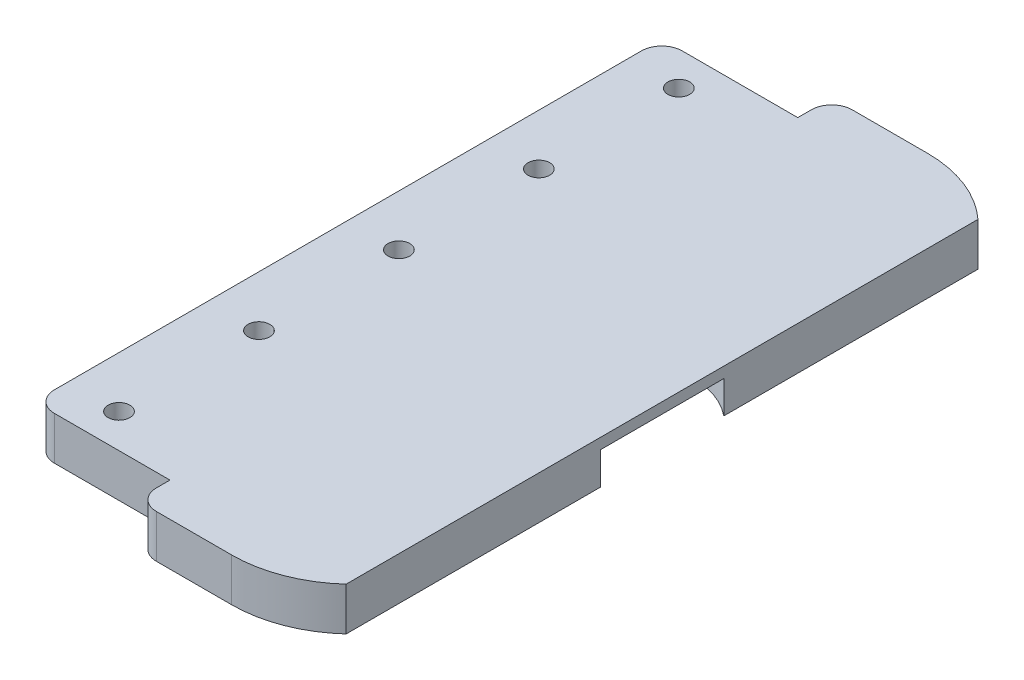
from build123d import *

# Parameters (mm, degrees)
SKETCH1_W           = 52.084
SKETCH1_H           = 102.362
BOSS_EXTRUDE1_DEPTH = 6.35
SKETCH1_4_R         = 1.6
CUT_EXTRUDE2_DEPTH  = 116.026277867
SKETCH1_5_R         = 3.45
CUT_EXTRUDE3_DEPTH  = 4.7625
FILLET1_R           = 18
SKETCH1_7_W         = 20
SKETCH1_7_H         = 5
CUT_EXTRUDE4_DEPTH  = 116.026277867
FILLET4_R           = 3
SKETCH3_W           = 22.451753575
SKETCH3_H           = 92.950303638
CUT_EXTRUDE6_DEPTH  = 6.35


with BuildPart() as part:
    # Sketch1 → Boss-Extrude1 (new body)
    with BuildSketch(Plane(origin=(0, 0, 0), x_dir=(1, 0, 0), z_dir=(0, 1, 0))):
        with Locations((26.042, 51.181)):
            Rectangle(SKETCH1_W, SKETCH1_H)
    extrude(amount=BOSS_EXTRUDE1_DEPTH)

    # Sketch1<4> → Cut-Extrude2 (cut, through all)
    with BuildSketch(Plane(origin=(0, 0, 0), x_dir=(1, 0, 0), z_dir=(0, 1, 0))):
        with BuildLine():
            ThreePointArc((9.1, 71.772), (8.63137085, 72.90337085), (7.5, 73.372))
            Line((7.5, 73.372), (7.5, 70.172))
            ThreePointArc((7.5, 70.172), (8.63137085, 70.64062915), (9.1, 71.772))
        make_face()
        with BuildLine():
            Line((7.5, 70.172), (7.5, 73.372))
            ThreePointArc((7.5, 73.372), (5.9, 71.772), (7.5, 70.172))
        make_face()
        with Locations(Location((7.5, 92.362, 0), (0, 0, 270))):
            Circle(SKETCH1_4_R)
        with Locations(Location((7.5, 51.182, 0), (0, 0, 270))):
            Circle(SKETCH1_4_R)
        with Locations(Location((7.5, 30.592, 0), (0, 0, 270))):
            Circle(SKETCH1_4_R)
        with Locations(Location((7.5, 10.002, 0), (0, 0, 270))):
            Circle(SKETCH1_4_R)
    extrude(amount=CUT_EXTRUDE2_DEPTH, mode=Mode.SUBTRACT)

    # Sketch1<5> → Cut-Extrude3 (cut)
    with BuildSketch(Plane(origin=(0, 0, 0), x_dir=(1, 0, 0), z_dir=(0, 1, 0))):
        with Locations(Location((38.876, 95.63, 0), (0, 0, 90))):
            Circle(SKETCH1_5_R)
        with Locations(Location((38.876, 6.73, 0), (0, 0, 90))):
            Circle(SKETCH1_5_R)
        with BuildLine():
            Line((30.360375772, 43.18), (30.360375772, 59.18))
            ThreePointArc((30.360375772, 59.18), (50.56, 51.18), (30.360375772, 43.18))
        make_face()
    extrude(amount=CUT_EXTRUDE3_DEPTH, mode=Mode.SUBTRACT)

    # Fillet1
    fillet1_edges = [part.edges().sort_by_distance(p)[0] for p in [
        (52.084, 3.175, 0),
        (52.084, 3.175, -102.362),
    ]]
    fillet(fillet1_edges, radius=FILLET1_R)

    # Sketch1<7> → Cut-Extrude4 (cut, through all)
    with BuildSketch(Plane(origin=(0, 0, 0), x_dir=(1, 0, 0), z_dir=(0, 1, 0))):
        with Locations((10, 2.5)):
            Rectangle(SKETCH1_7_W, SKETCH1_7_H)
        with Locations((10, 99.862)):
            Rectangle(SKETCH1_7_W, SKETCH1_7_H)
    extrude(amount=CUT_EXTRUDE4_DEPTH, mode=Mode.SUBTRACT)

    # Fillet4
    fillet4_edges = [part.edges().sort_by_distance(p)[0] for p in [
        (0, 3.175, -5),
        (20, 3.175, 0),
        (0, 3.175, -97.362),
        (20, 3.175, -102.362),
    ]]
    fillet(fillet4_edges, radius=FILLET4_R)

    # Sketch3 → Cut-Extrude6 (cut)
    with BuildSketch(Plane.XZ):
        with Locations((57.445177666, -51.181)):
            Rectangle(SKETCH3_W, SKETCH3_H)
    extrude(amount=-CUT_EXTRUDE6_DEPTH, mode=Mode.SUBTRACT)


solid = part.part
